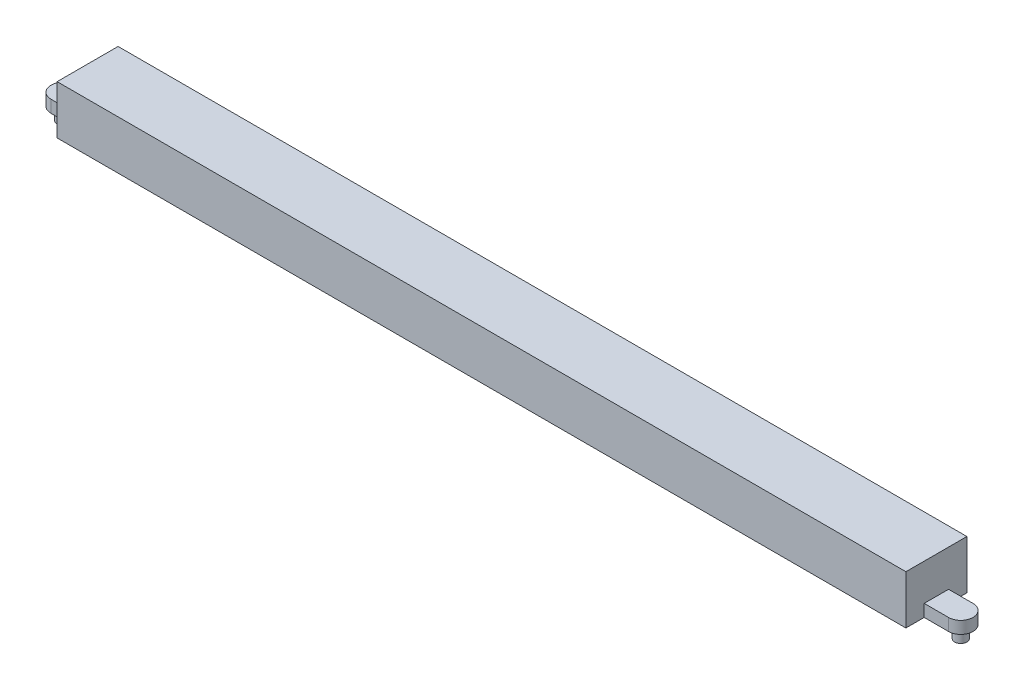
from build123d import *

# Parameters (mm, degrees)
SKETCH1_W           = 67.6
SKETCH1_H           = 4
BASE_DEPTH          = 1
NOCK_DEPTH          = 1
WALLS_DEPTH         = 3
SKETCH4_W           = 69.6
SKETCH4_H           = 5
TOP_DEPTH           = 1
MOUNTINGTABS_DEPTH  = 1
SKETCH6_R           = 0.5
BOSS_EXTRUDE7_DEPTH = 1


with BuildPart() as part:
    # Sketch1 → Base (new body)
    with BuildSketch(Plane(origin=(0, 0, 0), x_dir=(1, 0, 0), z_dir=(0, 1, 0))):
        Rectangle(SKETCH1_W, SKETCH1_H)
    extrude(amount=BASE_DEPTH)

    # Sketch2 → nock (add)
    with BuildSketch(Plane(origin=(0, 1, 0), x_dir=(1, 0, 0), z_dir=(0, 1, 0))):
        with BuildLine():
            Line((-18.1, -2.5), (-18.1, 1))
            ThreePointArc((-18.1, 1), (-17.7, 1.4), (-17.3, 1))
            Line((-17.3, 1), (-17.3, -2.5))
            Line((-17.3, -2.5), (-18.1, -2.5))
        make_face()
    extrude(amount=NOCK_DEPTH)

    # Sketch3 → Walls (add)
    with BuildSketch(Plane(origin=(0, 0, 0), x_dir=(1, 0, 0), z_dir=(0, 1, 0))):
        Polygon((-33.8, 2), (-34.8, 2), (-34.8, -3), (34.8, -3), (34.8, 2), (33.8, 2), (33.8, -2), (-33.8, -2), align=None)
    extrude(amount=WALLS_DEPTH)

    # Sketch4 → Top (add)
    with BuildSketch(Plane(origin=(0, 3, 0), x_dir=(1, 0, 0), z_dir=(0, 1, 0))):
        with Locations((0, -0.5)):
            Rectangle(SKETCH4_W, SKETCH4_H)
    extrude(amount=TOP_DEPTH)

    # Sketch5 → MountingTabs (add)
    with BuildSketch(Plane(origin=(0, 0, 0), x_dir=(1, 0, 0), z_dir=(0, 1, 0))):
        with BuildLine():
            Line((-34.8, 0.5), (-34.8, -1.5))
            Line((-34.8, -1.5), (-36.8, -1.5))
            ThreePointArc((-36.8, -1.5), (-37.8, -0.5), (-36.8, 0.5))
            Line((-36.8, 0.5), (-34.8, 0.5))
        make_face()
        with BuildLine():
            Line((34.8, -1.5), (36.8, -1.5))
            ThreePointArc((36.8, -1.5), (37.8, -0.5), (36.8, 0.5))
            Line((36.8, 0.5), (34.8, 0.5))
            Line((34.8, 0.5), (34.8, -1.5))
        make_face()
    extrude(amount=MOUNTINGTABS_DEPTH)

    # Sketch6 → Boss-Extrude7 (add)
    with BuildSketch(Plane.XZ):
        with Locations(Location((-36.8, 0.5, 0), (0, 0, 270))):
            Circle(SKETCH6_R)
        with Locations(Location((36.8, 0.5, 0), (0, 0, 270))):
            Circle(SKETCH6_R)
    extrude(amount=BOSS_EXTRUDE7_DEPTH)


solid = part.part
